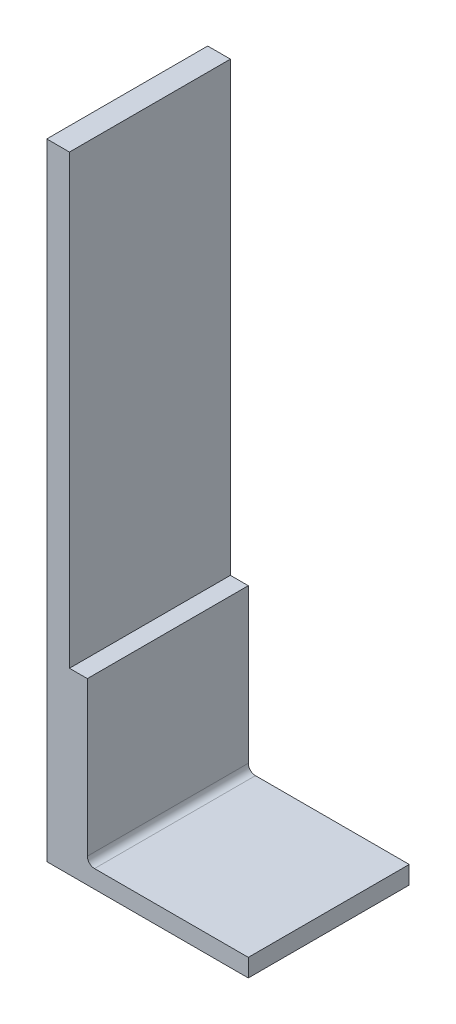
from build123d import *

# Parameters (mm, degrees)
SALIENTE_EXTRUIR1_DEPTH = 90
CROQUIS2_W              = 90
CROQUIS2_H              = 350
SALIENTE_EXTRUIR2_DEPTH = 12.7


with BuildPart() as part:
    # Croquis1 → Saliente-Extruir1 (new body)
    with BuildSketch(Plane.XY):
        with BuildLine():
            Line((0, 0), (0, 100))
            Line((0, 100), (10, 100))
            Line((10, 100), (10, 14))
            ThreePointArc((10, 14), (11.171572875, 11.171572875), (14, 10))
            Line((14, 10), (100, 10))
            Line((100, 10), (100, 0))
            Line((100, 0), (0, 0))
        make_face()
    extrude(amount=SALIENTE_EXTRUIR1_DEPTH)

    # Croquis2 → Saliente-Extruir2 (add)
    with BuildSketch(Plane.ZY):
        with Locations((45, 175)):
            Rectangle(CROQUIS2_W, CROQUIS2_H)
    extrude(amount=SALIENTE_EXTRUIR2_DEPTH)


solid = part.part
